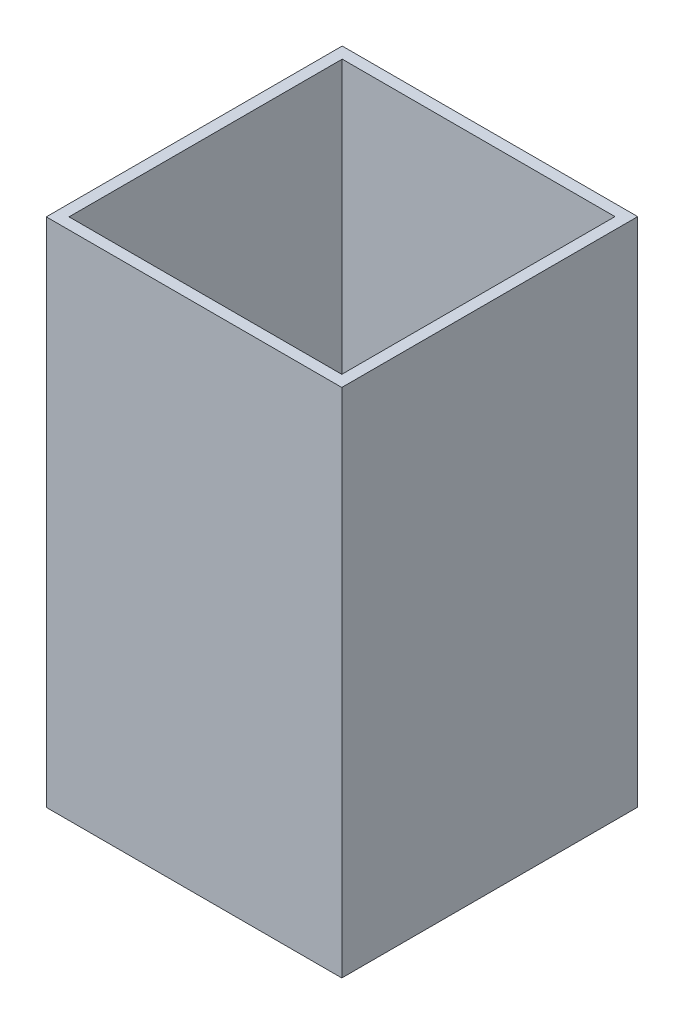
from build123d import *

# Parameters (mm, degrees)
ESQUISSE1_W             = 260
ESQUISSE1_H             = 450
BOSS_EXTRU_1_DEPTH      = 130.18
ENL_V_MAT_EXTRU_1_REACH = 488.155
ESQUISSE2_W             = 240
ESQUISSE2_H             = 240.36


with BuildPart() as part:
    # Esquisse1 → Boss.-Extru.1 (new, symmetric)
    with BuildSketch(Plane.XY):
        Rectangle(ESQUISSE1_W, ESQUISSE1_H)
    extrude(amount=BOSS_EXTRU_1_DEPTH, both=True)

    # Esquisse2 → Enlèv. mat.-Extru.1 (cut, up to next)
    with BuildSketch(Plane(origin=(0, 225, 0), x_dir=(1, 0, 0), z_dir=(0, 1, 0)), mode=Mode.PRIVATE) as enl_v_mat_extru_1_sk1:
        Rectangle(ESQUISSE2_W, ESQUISSE2_H)
    enl_v_mat_extru_1_tool1 = extrude(enl_v_mat_extru_1_sk1.sketch, amount=-ENL_V_MAT_EXTRU_1_REACH, mode=Mode.PRIVATE) & part.part
    add(enl_v_mat_extru_1_tool1.solids().sort_by_distance((0, 225, 0))[0], mode=Mode.SUBTRACT)


solid = part.part
